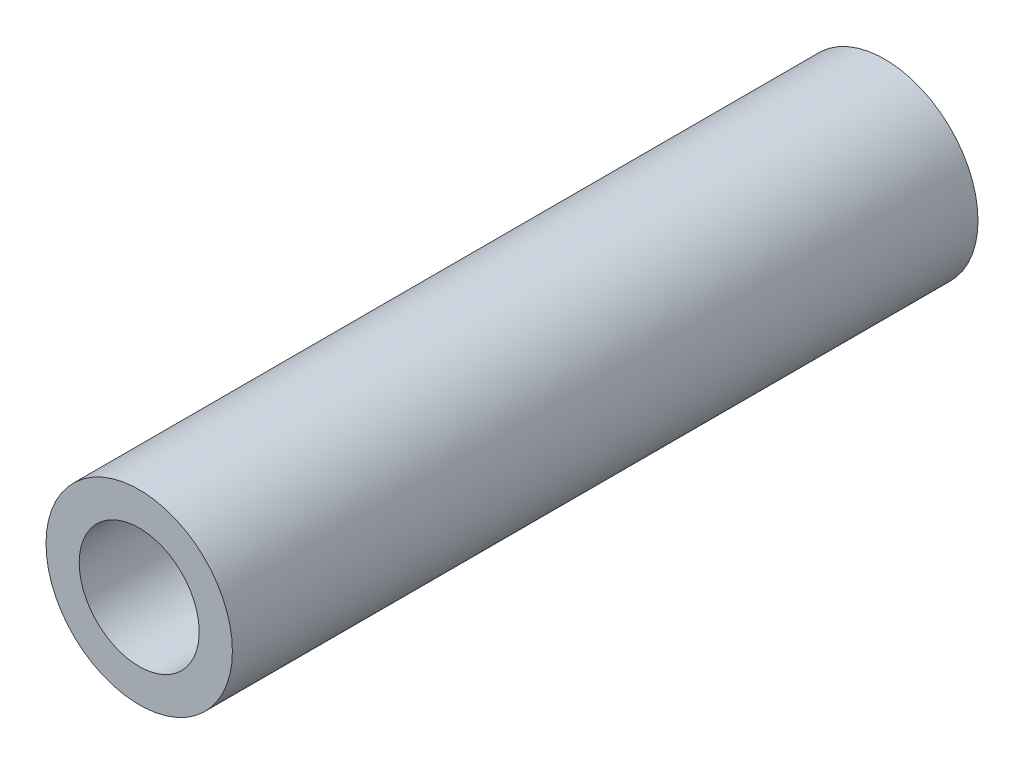
from build123d import *

# Parameters (mm, degrees)
SKETCH1_R           = 3.96875
SKETCH1_R_2         = 2.555
BOSS_EXTRUDE1_DEPTH = 31.75


with BuildPart() as part:
    # Sketch1 → Boss-Extrude1 (new body)
    with BuildSketch(Plane.XY):
        with Locations(Location((0, 0, 0), (0, 0, 180))):
            Circle(SKETCH1_R)
        with Locations(Location((0, 0, 0), (0, 0, 180))):
            Circle(SKETCH1_R_2, mode=Mode.SUBTRACT)
    extrude(amount=BOSS_EXTRUDE1_DEPTH)


solid = part.part
